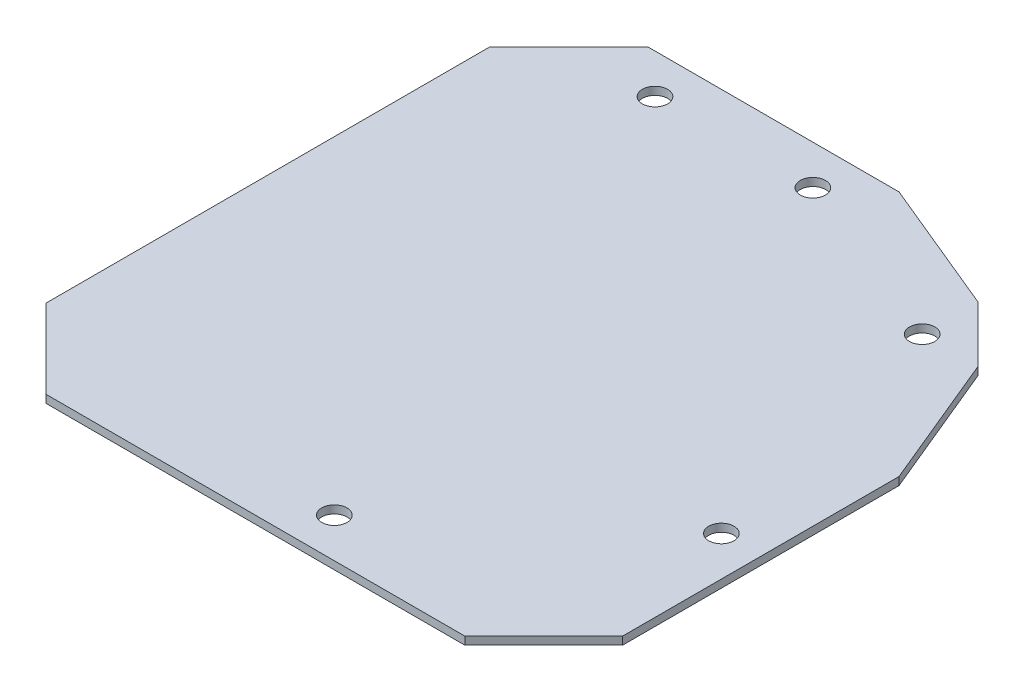
from build123d import *

# Parameters (mm, degrees)
EXTRUDE_1_DEPTH     = 1
SKETCH_2_W          = 31.819805153
SKETCH_2_H          = 31.819805153
CUT_EXTRUDE_1_DEPTH = 10
CHAMFER_1_SIZE      = 10
SKETCH_4_R          = 1.6
CUT_EXTRUDE_3_DEPTH = 10
SKETCH_5_W          = 20
SKETCH_5_H          = 76.213203436
EXTRUDE_2_DEPTH     = 1
CHAMFER_2_SIZE      = 10
SKETCH_6_R          = 1.6
CUT_EXTRUDE_4_DEPTH = 10


with BuildPart() as part:
    # 草图1 → 凸台-拉伸1 (new body)
    with BuildSketch(Plane(origin=(0, 0, 0), x_dir=(1, 0, 0), z_dir=(0, 1, 0))):
        Polygon((0, 0), (53.033008589, 0), (53.033008589, 55), (0, 108.033008589), align=None)
    extrude(amount=EXTRUDE_1_DEPTH)

    # 草图2 → 切除-拉伸1 (cut)
    with BuildSketch(Plane.XZ):
        with Locations((15.909902577, -92.123106013)):
            Rectangle(SKETCH_2_W, SKETCH_2_H)
    extrude(amount=-CUT_EXTRUDE_1_DEPTH, mode=Mode.SUBTRACT)

    # 倒角1
    chamfer_1_edges = [part.edges().sort_by_distance(p)[0] for p in [
        (31.819805153, 0.5, -76.213203436),
        (53.033008589, 0.5, -55),
        (53.033008589, 0.5, 0),
    ]]
    chamfer(chamfer_1_edges, length=CHAMFER_1_SIZE)

    # 草图4 → 切除-拉伸3 (cut)
    with BuildSketch(Plane(origin=(0, 1, 0), x_dir=(1, 0, 0), z_dir=(0, 1, 0))):
        with Locations(Location((38.890872965, 62.071067812, 0), (0, 0, 270))):
            Circle(SKETCH_4_R)
        with Locations(Location((48.033008589, 27.5, 0), (0, 0, 270))):
            Circle(SKETCH_4_R)
        with Locations(Location((21.516504294, 5, 0), (0, 0, 270))):
            Circle(SKETCH_4_R)
    extrude(amount=-CUT_EXTRUDE_3_DEPTH, mode=Mode.SUBTRACT)

    # 草图5 → 凸台-拉伸2 (add)
    with BuildSketch(Plane.XZ):
        with Locations((-10, -38.106601718)):
            Rectangle(SKETCH_5_W, SKETCH_5_H)
    extrude(amount=-EXTRUDE_2_DEPTH)

    # 倒角2
    chamfer_2_edges = [part.edges().sort_by_distance(p)[0] for p in [
        (-20, 0.5, 0),
        (-20, 0.5, -76.213203436),
    ]]
    chamfer(chamfer_2_edges, length=CHAMFER_2_SIZE)

    # 草图6 → 切除-拉伸4 (cut)
    with BuildSketch(Plane.XZ):
        with Locations(Location((15.909902577, -71.213203436, 0), (0, 0, 270))):
            Circle(SKETCH_6_R)
        with Locations(Location((-4.090097423, -71.213203436, 0), (0, 0, 270))):
            Circle(SKETCH_6_R)
    extrude(amount=-CUT_EXTRUDE_4_DEPTH, mode=Mode.SUBTRACT)


solid = part.part
